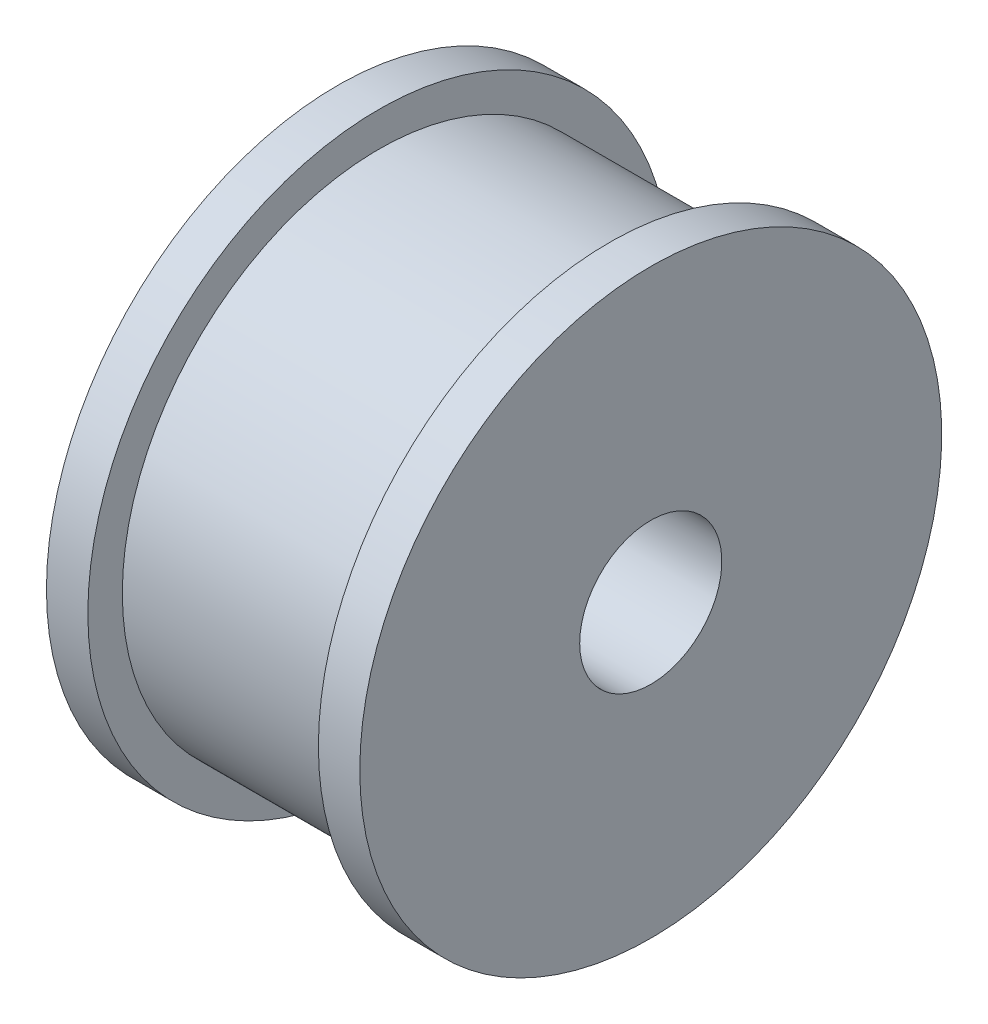
from build123d import *

# Parameters (mm, degrees)
F_1_4_0_25_DIAMETER_HOLE1_D = 6.35


with BuildPart() as part:
    # Sketch1 → Revolve1 (revolve)
    with BuildSketch(Plane(origin=(0, 0, 0), x_dir=(1, 0, 0), z_dir=(0, 1, 0))):
        Polygon((0, -11.46), (-5.15, -11.46), (-5.15, -13), (-7, -13), (-7, 0), (7, 0), (7, -13), (5.15, -13), (5.15, -11.46), align=None)
    revolve(axis=Axis((-7, 0, 0), (1, 0, 0)))

    # 1/4 (0.25) Diameter Hole1 (through all)
    with Locations(Plane.ZY.offset(7)):
        with Locations((0, 0)):
            Hole(F_1_4_0_25_DIAMETER_HOLE1_D / 2)


solid = part.part
